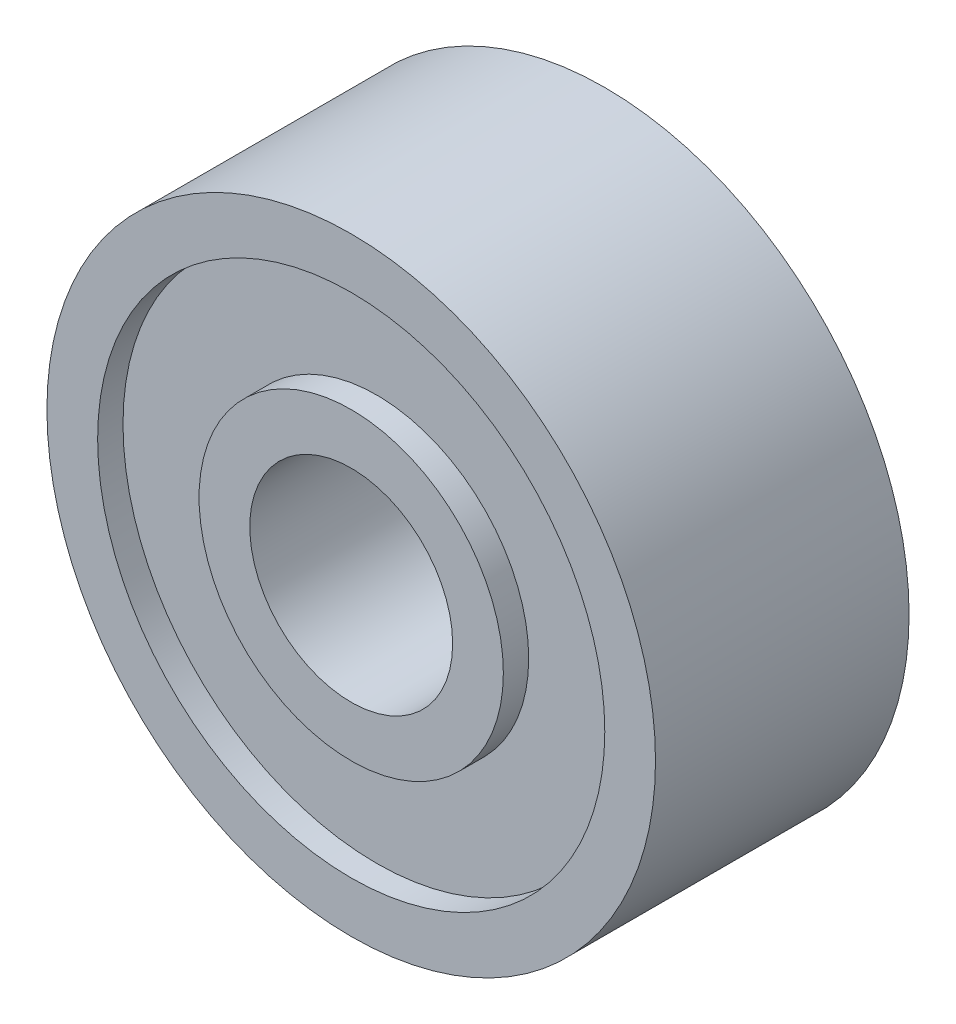
from build123d import *

# Parameters (mm, degrees)
SALIENTE_EXTRUIR2_DEPTH        = 2.5
SALIENTE_EXTRUIR2_DEPTH_BACK   = 2.5
CROQUIS1_R                     = 6
CROQUIS1_R_2                   = 5
SALIENTE_EXTRUIR2_2_DEPTH      = 2.5
SALIENTE_EXTRUIR2_2_DEPTH_BACK = 2.5
CROQUIS1_R_3                   = 3
CROQUIS1_R_4                   = 2
SALIENTE_EXTRUIR3_DEPTH        = 2
SALIENTE_EXTRUIR3_DEPTH_BACK   = 2
CROQUIS1_3_R                   = 5
CROQUIS1_3_R_2                 = 3


with BuildPart() as part:
    # Croquis1 → Saliente-Extruir2 (new, two sides: drawn at the far end of the back side and taken through both)
    with BuildSketch(Plane.XY.offset(-SALIENTE_EXTRUIR2_DEPTH_BACK)):
        Circle(CROQUIS1_R)
        Circle(CROQUIS1_R_2, mode=Mode.SUBTRACT)
    extrude(amount=SALIENTE_EXTRUIR2_DEPTH + SALIENTE_EXTRUIR2_DEPTH_BACK)



with BuildPart() as body_2:
    # Croquis1 → Saliente-Extruir2 2 (new, two sides: drawn at the far end of the back side and taken through both)
    with BuildSketch(Plane.XY.offset(-SALIENTE_EXTRUIR2_2_DEPTH_BACK)):
        Circle(CROQUIS1_R_3)
        Circle(CROQUIS1_R_4, mode=Mode.SUBTRACT)
    extrude(amount=SALIENTE_EXTRUIR2_2_DEPTH + SALIENTE_EXTRUIR2_2_DEPTH_BACK)


with BuildPart() as part_1:
    add(part.part)

    add(body_2.part)  # Saliente-Extruir3 merges body 2
    # Croquis1<3> → Saliente-Extruir3 (add, two sides: drawn at the far end of the back side and taken through both)
    with BuildSketch(Plane.XY.offset(-SALIENTE_EXTRUIR3_DEPTH_BACK)):
        Circle(CROQUIS1_3_R)
        Circle(CROQUIS1_3_R_2, mode=Mode.SUBTRACT)
    extrude(amount=SALIENTE_EXTRUIR3_DEPTH + SALIENTE_EXTRUIR3_DEPTH_BACK)


solid = part_1.part
